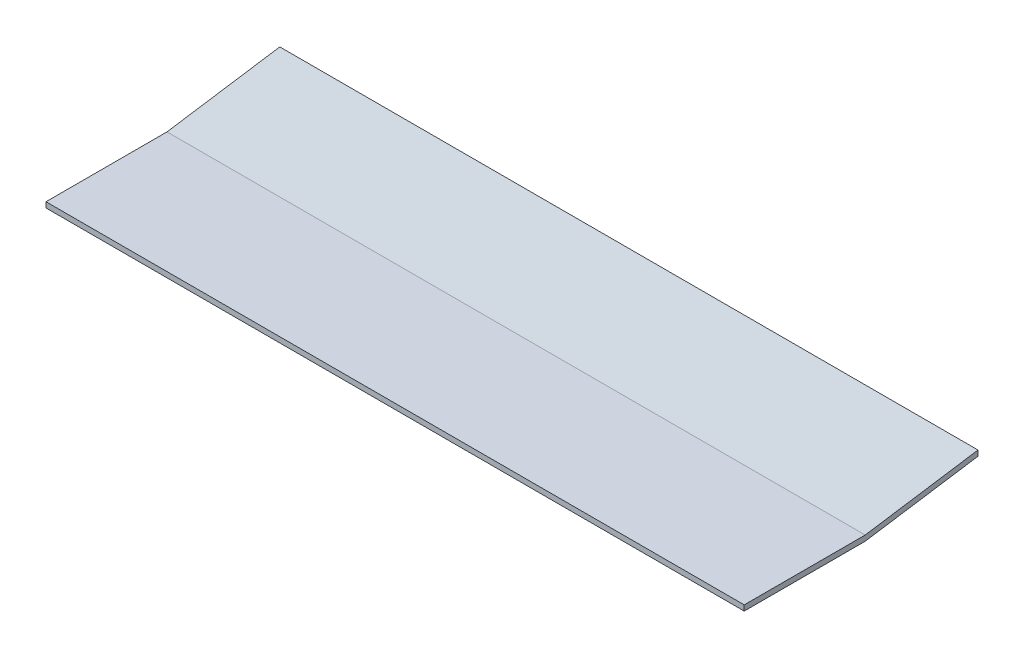
from build123d import *

# Parameters (mm, degrees)
EXTRUDE_1_DEPTH = 6170


with BuildPart() as part:
    # Эскиз1 → Бобышка-Вытянуть1 (new body)
    with BuildSketch(Plane(origin=(0, 0, 0), x_dir=(0, 0, -1), z_dir=(1, 0, 0))):
        Polygon((66.389957095, 15.430478309), (-930.173771496, -136.649239627), (-1999.3941377, -136.649239627), (-1999.3941377, -184.59634125), (-930.173771496, -184.59634125), (66.389957095, -32.516623314), align=None)
    extrude(amount=EXTRUDE_1_DEPTH)


solid = part.part
